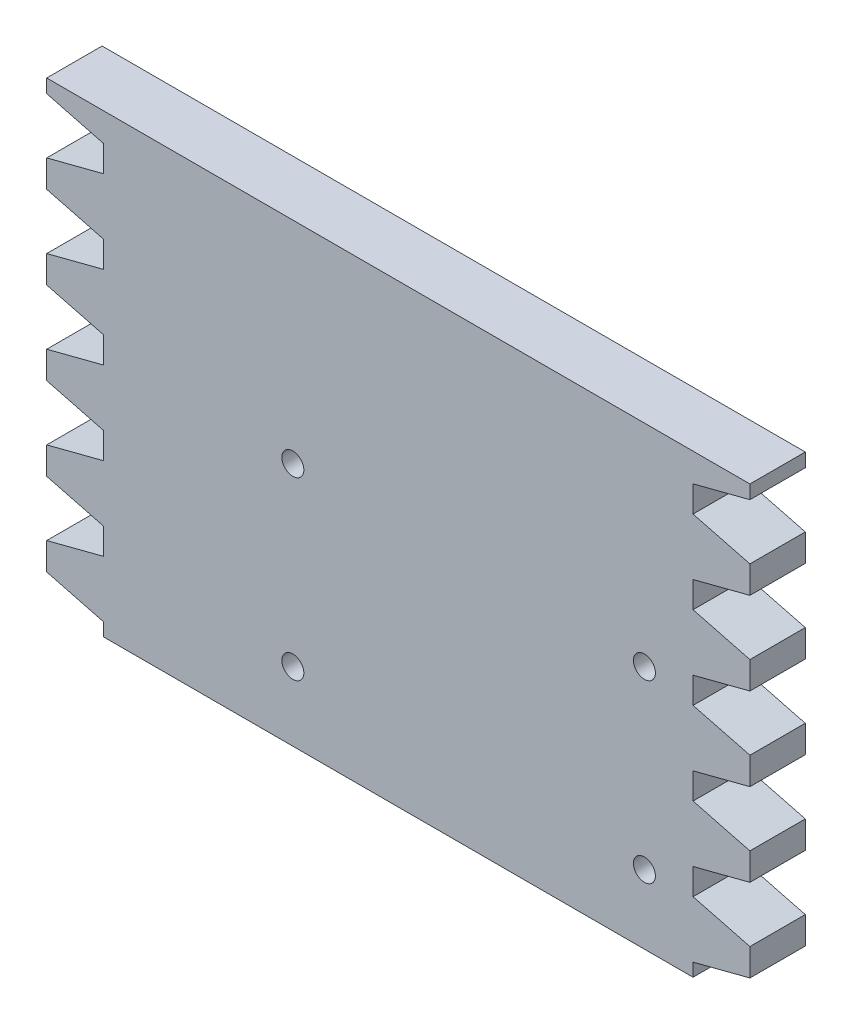
from build123d import *

# Parameters (mm, degrees)
BOSS_EXTRUDE1_DEPTH = 4
SKETCH2_R           = 0.79375
CUT_EXTRUDE1_DEPTH  = 4


with BuildPart() as part:
    # Sketch1 → Boss-Extrude1 (new body)
    with BuildSketch(Plane.XY):
        Polygon((-19.05, 32.916114), (31.75, 32.916114), (31.75, 31.931727843), (27.640915, 30.869046207), (27.640915, 28.978433793), (31.75, 27.915752157), (31.75, 25.946979843), (27.640915, 24.884298207), (27.640915, 22.993685793), (31.75, 21.931004157), (31.75, 19.962231843), (27.640915, 18.899550207), (27.640915, 17.008937793), (31.75, 15.946256157), (31.75, 13.977483843), (27.640915, 12.914802207), (27.640915, 11.024189793), (31.75, 9.961508157), (31.75, 7.992735843), (27.640915, 6.930054207), (27.640915, 5.039441793), (31.75, 3.976760157), (31.75, 2.007987843), (27.640915, 0.945306207), (27.640915, 0), (-14.940915, 0), (-14.940915, 0.945306207), (-19.05, 2.007987843), (-19.05, 3.976760157), (-14.940915, 5.039441793), (-14.940915, 6.930054207), (-19.05, 7.992735843), (-19.05, 9.961508157), (-14.940915, 11.024189793), (-14.940915, 12.914802207), (-19.05, 13.977483843), (-19.05, 15.946256157), (-14.940915, 17.008937793), (-14.940915, 18.899550207), (-19.05, 19.962231843), (-19.05, 21.931004157), (-14.940915, 22.993685793), (-14.940915, 24.884298207), (-19.05, 25.946979843), (-19.05, 27.915752157), (-14.940915, 28.978433793), (-14.940915, 30.869046207), (-19.05, 31.931727843), align=None)
    extrude(amount=BOSS_EXTRUDE1_DEPTH)

    # Sketch2 → Cut-Extrude1 (cut)
    with BuildSketch(Plane.XY.offset(4)):
        with Locations((-1.27, 17.676114)):
            Circle(SKETCH2_R)
        with Locations((24.13, 17.676114)):
            Circle(SKETCH2_R)
        with Locations((24.13, 4.976114)):
            Circle(SKETCH2_R)
        with Locations((-1.27, 4.976114)):
            Circle(SKETCH2_R)
    extrude(amount=-CUT_EXTRUDE1_DEPTH, mode=Mode.SUBTRACT)


solid = part.part
